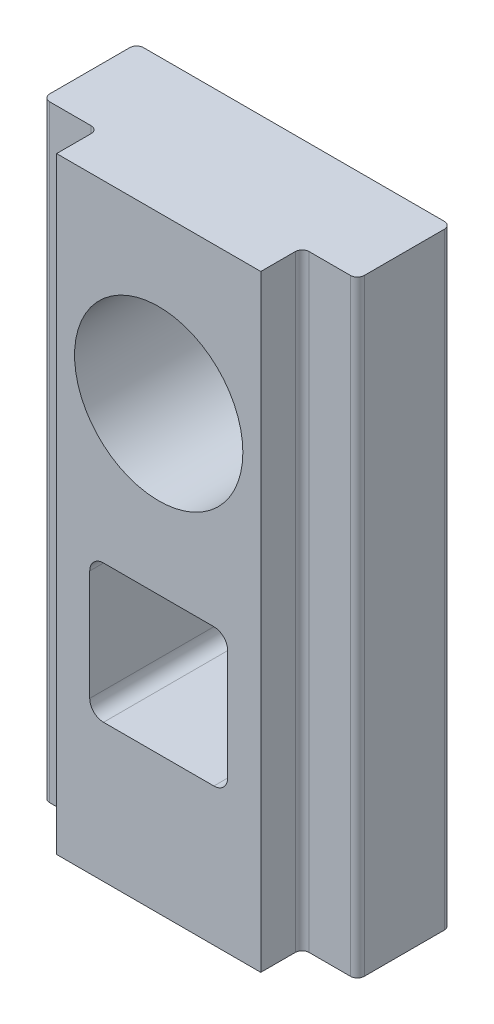
from build123d import *

# Parameters (mm, degrees)
BOSS_EXTRUDE1_DEPTH = 22
SKETCH2_R           = 3.05
SKETCH2_W           = 5
SKETCH2_H           = 5
CUT_EXTRUDE1_DEPTH  = 24.248655875
FILLET1_R           = 0.25
FILLET2_R           = 0.5


with BuildPart() as part:
    # Sketch1 → Boss-Extrude1 (new body)
    with BuildSketch(Plane(origin=(0, 0, 0), x_dir=(1, 0, 0), z_dir=(0, 1, 0))):
        Polygon((3.7, 0.3), (3.7, -1.2), (-3.7, -1.2), (-3.7, 0.3), (-5.7, 0.3), (-5.7, 3.7), (5.7, 3.7), (5.7, 0.3), align=None)
    extrude(amount=-BOSS_EXTRUDE1_DEPTH)

    # Sketch2 → Cut-Extrude1 (cut, through all)
    with BuildSketch(Plane.XY.offset(1.2)):
        with Locations((0, -6)):
            Circle(SKETCH2_R)
        with Locations((0, -14.5)):
            Rectangle(SKETCH2_W, SKETCH2_H)
    extrude(amount=-CUT_EXTRUDE1_DEPTH, mode=Mode.SUBTRACT)

    # Fillet1
    fillet1_edges = [part.edges().sort_by_distance(p)[0] for p in [
        (3.7, -11, -0.3),
        (-3.7, -11, -0.3),
        (-5.7, -11, -0.3),
        (-5.7, -11, -3.7),
        (5.7, -11, -3.7),
        (5.7, -11, -0.3),
    ]]
    fillet(fillet1_edges, radius=FILLET1_R)

    # Fillet2
    fillet2_edges = [part.edges().sort_by_distance(p)[0] for p in [
        (2.5, -12, -1.25),
        (2.5, -17, -1.25),
        (-2.5, -17, -1.25),
        (-2.5, -12, -1.25),
    ]]
    fillet(fillet2_edges, radius=FILLET2_R)


solid = part.part
